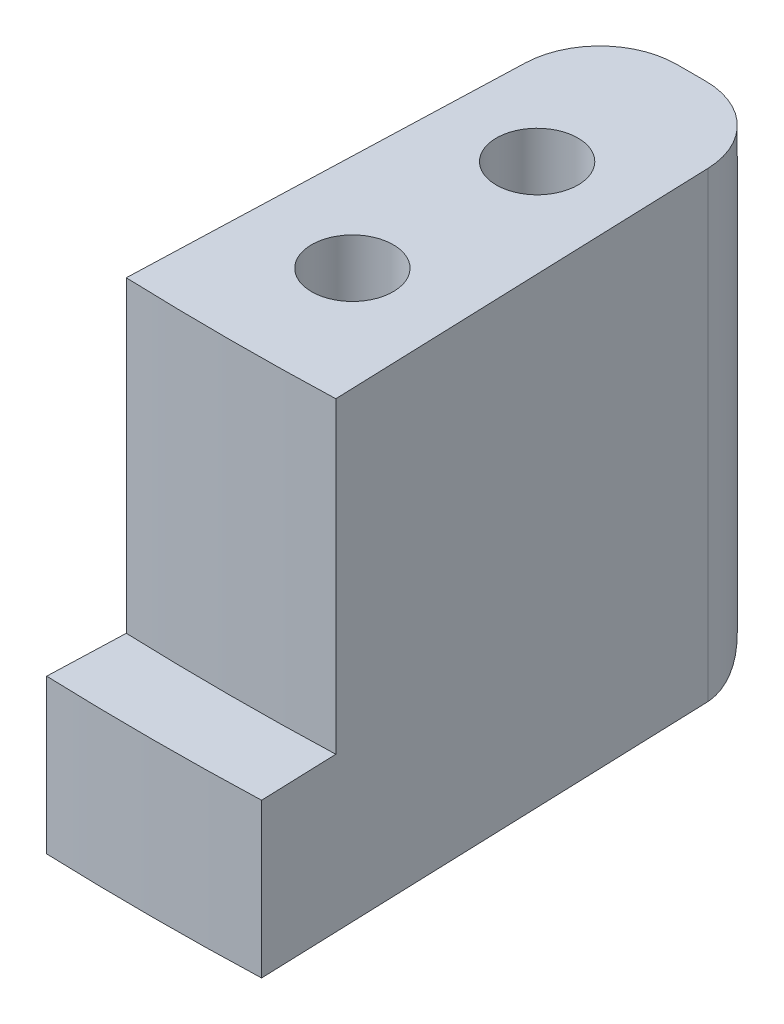
from build123d import *

# Parameters (mm, degrees)
EXTRUDE_583_DEPTH   = 30
EXTRUDE_631_DEPTH   = 10
FILLET_1_R          = 5
HOLE_WIZARD_M5_1_D  = 5.3
CUT_EXTRUDE_1_DEPTH = 5


with BuildPart() as part:
    # 草图1 → Extrude 583 (new body)
    with BuildSketch(Plane(origin=(0, 0, 0), x_dir=(1, 0, 0), z_dir=(0, 1, 0))):
        with BuildLine():
            Line((5.761926966, -165), (-5.761926966, -165))
            Line((-5.761926966, -165), (-6.805401857, -194.881211269))
            ThreePointArc((-6.805401857, -194.881211269), (0, -195), (6.805401857, -194.881211269))
            Line((6.805401857, -194.881211269), (5.761926966, -165))
        make_face()
    extrude(amount=EXTRUDE_583_DEPTH)

    # 草图1<3> → Extrude 631 (add)
    with BuildSketch(Plane(origin=(0, 0, 0), x_dir=(1, 0, 0), z_dir=(0, 1, 0))):
        with BuildLine():
            ThreePointArc((6.805401857, -194.881211269), (0, -195), (-6.805401857, -194.881211269))
            Line((-6.805401857, -194.881211269), (-6.979899341, -199.878165404))
            ThreePointArc((-6.979899341, -199.878165404), (0, -200), (6.979899341, -199.878165404))
            Line((6.979899341, -199.878165404), (6.805401857, -194.881211269))
        make_face()
    extrude(amount=EXTRUDE_631_DEPTH)

    # 圆角1
    fillet_1_edges = [part.edges().sort_by_distance(p)[0] for p in [
        (0, 0, 165),
        (-5.761926966, 15, 165),
        (5.761926966, 15, 165),
    ]]
    fillet(fillet_1_edges, radius=FILLET_1_R)

    # M5 间隙孔1 (through all)
    with Locations(Plane(origin=(0, 30, 0), x_dir=(1, 0, 0), z_dir=(0, 1, 0))):
        with Locations((0, -187), (0, -175)):
            Hole(HOLE_WIZARD_M5_1_D / 2)

    # 草图6 → 切除-拉伸1 (cut)
    with BuildSketch(Plane.XZ):
        Polygon((-4.792007234, 175), (-2.396003617, 170.85), (2.396003617, 170.85), (4.792007234, 175), (2.396003617, 179.15), (-2.396003617, 179.15), align=None)
        Polygon((-4.792007234, 187), (-2.396003617, 182.85), (2.396003617, 182.85), (4.792007234, 187), (2.396003617, 191.15), (-2.396003617, 191.15), align=None)
    extrude(amount=-CUT_EXTRUDE_1_DEPTH, mode=Mode.SUBTRACT)


solid = part.part
